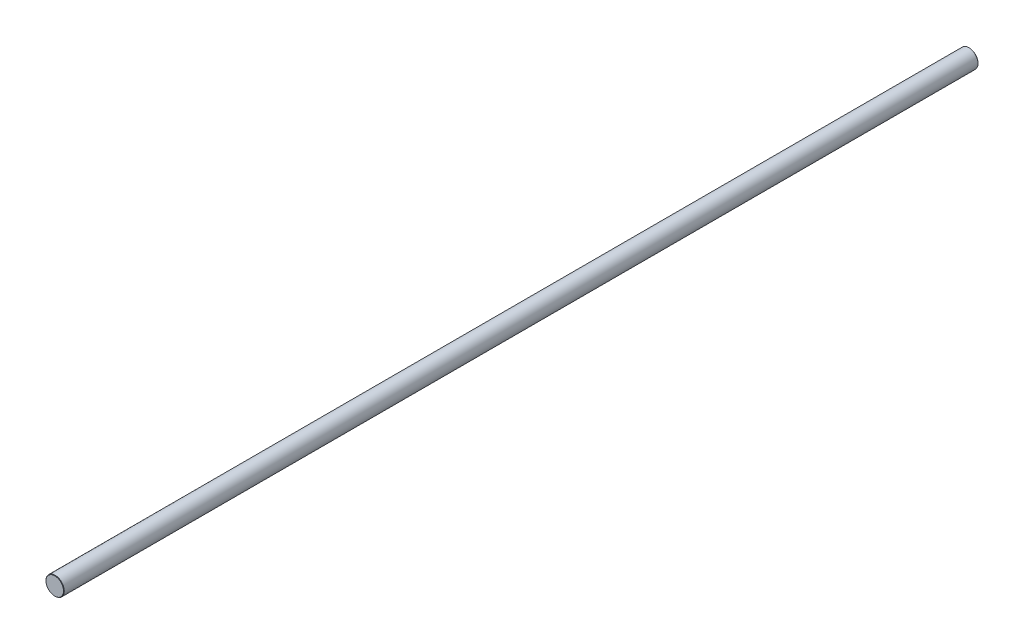
from build123d import *

# Parameters (mm, degrees)
BOSS_EXTRUDE1_DEPTH      = 200
BOSS_EXTRUDE1_DEPTH_BACK = 200
SKETCH2_R                = 4
CHAMFER1_SIZE            = 0.16


with BuildPart() as part:
    # Sketch2 → Boss-Extrude1 (new, two sides: drawn at the far end of the back side and taken through both)
    with BuildSketch(Plane.XY.offset(-BOSS_EXTRUDE1_DEPTH_BACK)):
        Circle(SKETCH2_R)
    extrude(amount=BOSS_EXTRUDE1_DEPTH + BOSS_EXTRUDE1_DEPTH_BACK)

    # Chamfer1
    chamfer1_edges = [part.edges().sort_by_distance(p)[0] for p in [
        (-4, 0, -200),
        (-4, 0, 200),
    ]]
    chamfer(chamfer1_edges, length=CHAMFER1_SIZE)


solid = part.part
